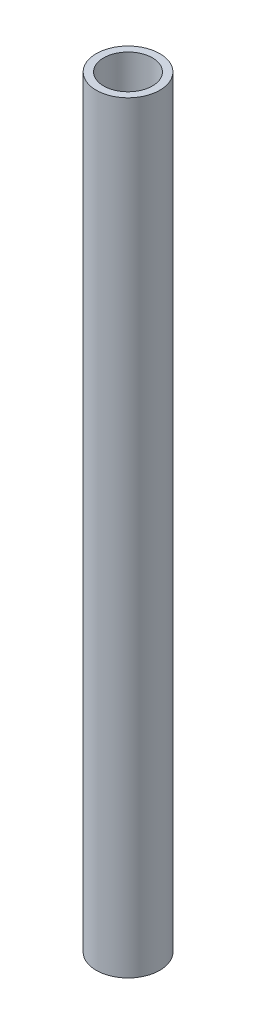
from build123d import *

# Parameters (mm, degrees)
SKETCH1_R           = 6.35
SKETCH1_R_2         = 4.8768
BOSS_EXTRUDE1_DEPTH = 152.4


with BuildPart() as part:
    # Sketch1 → Boss-Extrude1 (new body)
    with BuildSketch(Plane(origin=(0, 0, 0), x_dir=(1, 0, 0), z_dir=(0, 1, 0))):
        with Locations(Location((0, 0, 0), (0, 0, 90))):
            Circle(SKETCH1_R)
        with Locations(Location((0, 0, 0), (0, 0, 90))):
            Circle(SKETCH1_R_2, mode=Mode.SUBTRACT)
    extrude(amount=BOSS_EXTRUDE1_DEPTH)


solid = part.part
